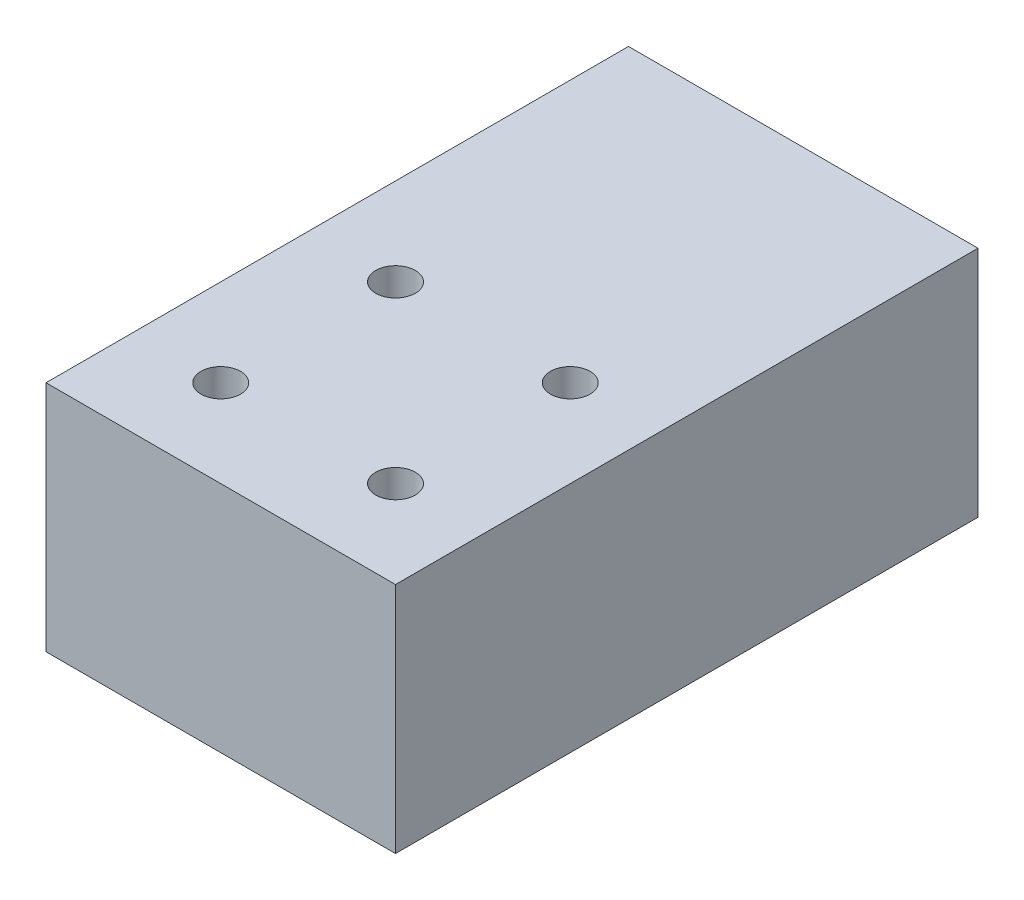
from build123d import *

# Parameters (mm, degrees)
SKETCH2_W           = 30
SKETCH2_H           = 20
BOSS_EXTRUDE1_DEPTH = 50
SKETCH3_R           = 1.7
CUT_EXTRUDE1_DEPTH  = 50


with BuildPart() as part:
    # Sketch2 → Boss-Extrude1 (new body)
    with BuildSketch(Plane.XY):
        with Locations((15, 10)):
            Rectangle(SKETCH2_W, SKETCH2_H)
    extrude(amount=BOSS_EXTRUDE1_DEPTH)

    # Sketch3 → Cut-Extrude1 (cut)
    with BuildSketch(Plane(origin=(0, 20, 0), x_dir=(1, 0, 0), z_dir=(0, 1, 0))):
        with Locations(Location((7.5, -27.5, 0), (0, 0, 270))):
            Circle(SKETCH3_R)
        with Locations(Location((22.5, -27.5, 0), (0, 0, 270))):
            Circle(SKETCH3_R)
        with Locations(Location((22.5, -42.5, 0), (0, 0, 270))):
            Circle(SKETCH3_R)
        with Locations(Location((7.5, -42.5, 0), (0, 0, 270))):
            Circle(SKETCH3_R)
    extrude(amount=-CUT_EXTRUDE1_DEPTH, mode=Mode.SUBTRACT)


solid = part.part
